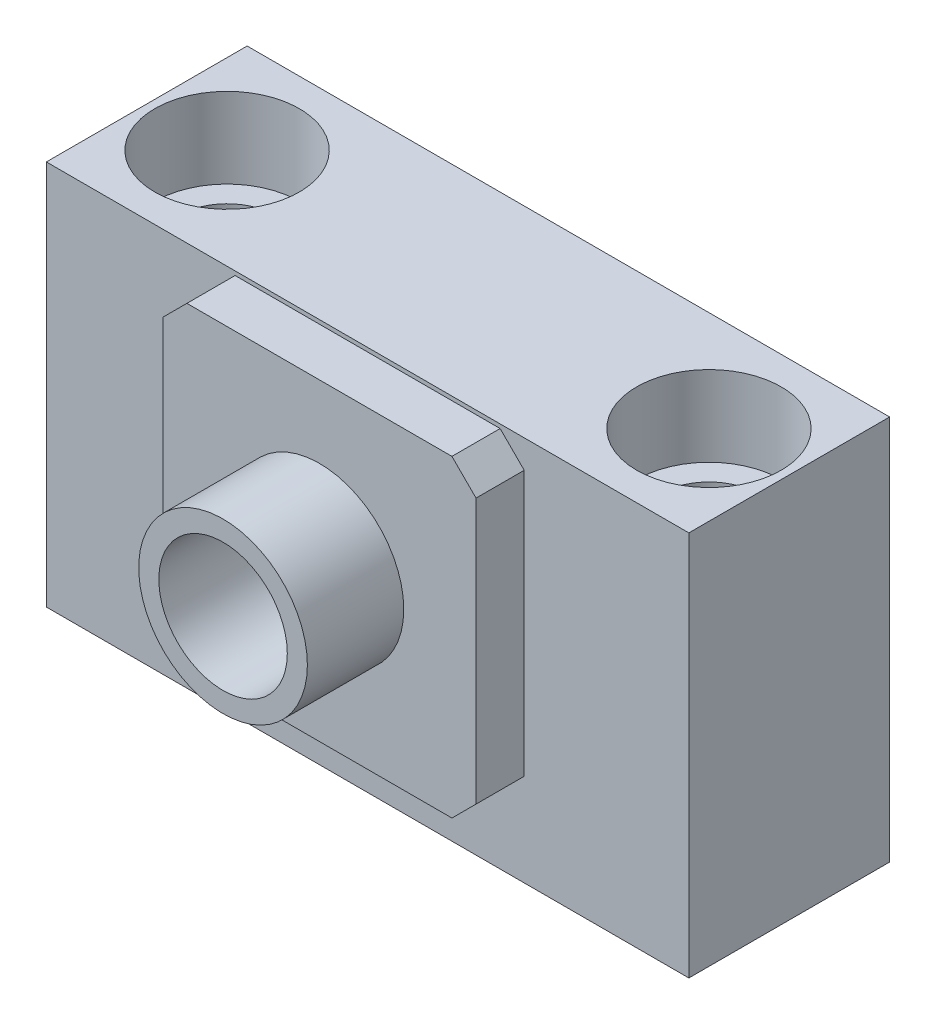
from build123d import *

# Parameters (mm, degrees)
SKETCH_1_W                    = 80
SKETCH_1_H                    = 48
EXTRUDE_1_DEPTH               = 25
SKETCH_2_W                    = 39
SKETCH_2_H                    = 39
EXTRUDE_2_DEPTH               = 6
CHAMFER_1_SIZE                = 3
SKETCH_3_R                    = 7.5
CUT_EXTRUDE_1_DEPTH           = 99.310731866
SKETCH_4_R                    = 10
CUT_EXTRUDE_2_DEPTH           = 5
HOLE_WIZARD_M10_1_D           = 12
HOLE_WIZARD_M10_1_CBORE_D     = 18
HOLE_WIZARD_M10_1_CBORE_DEPTH = 10
SKETCH_8_R                    = 10.5
SKETCH_8_R_2                  = 8
EXTRUDE_4_DEPTH               = 12


with BuildPart() as part:
    # 草图1 → 凸台-拉伸1 (new body)
    with BuildSketch(Plane.XY):
        with Locations((40, 24)):
            Rectangle(SKETCH_1_W, SKETCH_1_H)
    extrude(amount=EXTRUDE_1_DEPTH)

    # 草图2 → 凸台-拉伸2 (add)
    with BuildSketch(Plane.XY.offset(25)):
        with Locations((40, 28)):
            Rectangle(SKETCH_2_W, SKETCH_2_H)
    extrude(amount=EXTRUDE_2_DEPTH)

    # 倒角1
    chamfer_1_edges = [part.edges().sort_by_distance(p)[0] for p in [
        (20.5, 47.5, 28),
        (20.5, 8.5, 28),
        (59.5, 8.5, 28),
        (59.5, 47.5, 28),
    ]]
    chamfer(chamfer_1_edges, length=CHAMFER_1_SIZE)

    # 草图3 → 切除-拉伸1 (cut, through all)
    with BuildSketch(Plane(origin=(0, 0, 0), x_dir=(-1, 0, 0), z_dir=(0, 0, -1))):
        with Locations((-40, 28)):
            Circle(SKETCH_3_R)
    extrude(amount=-CUT_EXTRUDE_1_DEPTH, mode=Mode.SUBTRACT)

    # 草图4 → 切除-拉伸2 (cut)
    with BuildSketch(Plane(origin=(0, 0, 0), x_dir=(-1, 0, 0), z_dir=(0, 0, -1))):
        with Locations((-40, 28)):
            Circle(SKETCH_4_R)
    extrude(amount=-CUT_EXTRUDE_2_DEPTH, mode=Mode.SUBTRACT)

    # M10 六角凹头螺钉的柱形沉头孔1 (through all)
    with Locations(Plane(origin=(0, 48, 0), x_dir=(-1, 0, 0), z_dir=(0, 1, 0))):
        with Locations((-70, 12.5), (-10, 12.5)):
            CounterBoreHole(HOLE_WIZARD_M10_1_D / 2, HOLE_WIZARD_M10_1_CBORE_D / 2, HOLE_WIZARD_M10_1_CBORE_DEPTH)


with BuildPart() as body_2:
    # 草图8 → 凸台-拉伸4 (new body)
    with BuildSketch(Plane.XY.offset(31)):
        with Locations((40, 28)):
            Circle(SKETCH_8_R)
        with Locations((40, 28)):
            Circle(SKETCH_8_R_2, mode=Mode.SUBTRACT)
    extrude(amount=EXTRUDE_4_DEPTH)


solid = Compound([part.part, body_2.part])
